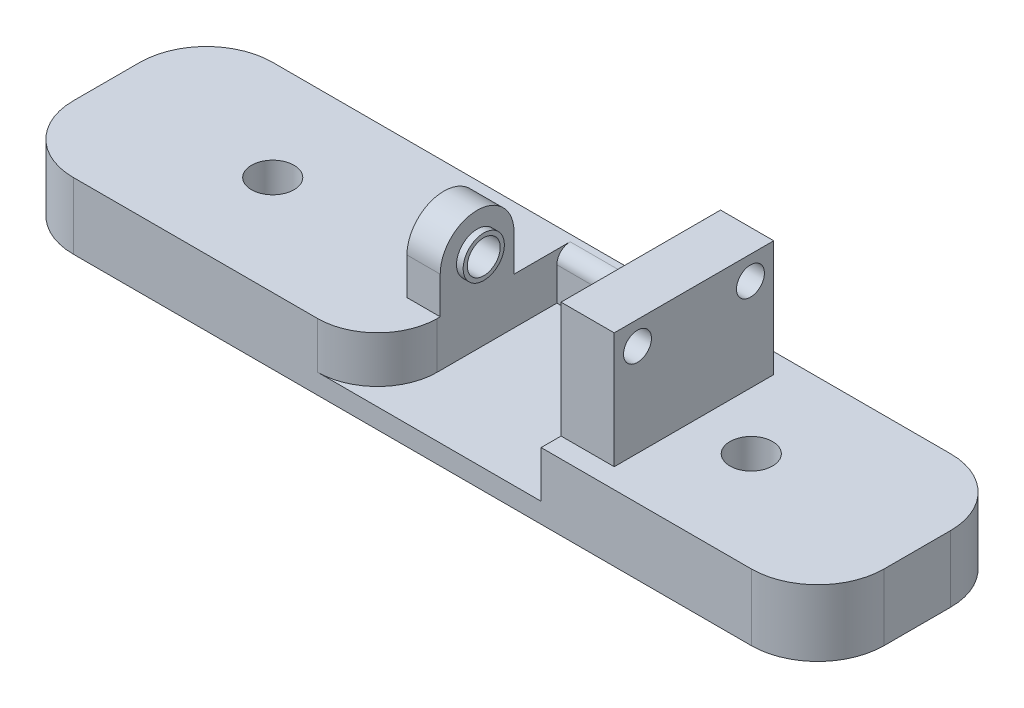
from build123d import *

# Parameters (mm, degrees)
SKETCH1_W           = 122
SKETCH1_H           = 30
BOSS_EXTRUDE1_DEPTH = 10
SKETCH2_W           = 24
SKETCH2_H           = 17.447802
BOSS_EXTRUDE2_DEPTH = 8
SKETCH3_R           = 2.475
BOSS_EXTRUDE3_DEPTH = 5
SKETCH4_W           = 24.63
SKETCH4_H           = 27
CUT_EXTRUDE1_DEPTH  = 7
FILLET1_R           = 10
SKETCH7_R           = 3.2
CUT_EXTRUDE2_DEPTH  = 66.195289666
BOSS_EXTRUDE5_START = 1
SKETCH8_R           = 3.1
SKETCH8_R_2         = 2.475
BOSS_EXTRUDE5_DEPTH = 1
FILLET2_R           = 9
FILLET3_R           = 2
SKETCH9_R           = 2.1
CUT_EXTRUDE3_DEPTH  = 8


with BuildPart() as part:
    # Sketch1 → Boss-Extrude1 (new body)
    with BuildSketch(Plane(origin=(0, 0, 0), x_dir=(1, 0, 0), z_dir=(0, 1, 0))):
        Rectangle(SKETCH1_W, SKETCH1_H)
    extrude(amount=BOSS_EXTRUDE1_DEPTH)

    # Sketch2 → Boss-Extrude2 (add)
    with BuildSketch(Plane(origin=(19.38, 0, 0), x_dir=(0, 0, -1), z_dir=(1, 0, 0))):
        with Locations((0, 18.723901)):
            Rectangle(SKETCH2_W, SKETCH2_H)
    extrude(amount=BOSS_EXTRUDE2_DEPTH)

    # Sketch3 → Boss-Extrude3 (add)
    with BuildSketch(Plane(origin=(-5.25, 0, 0), x_dir=(0, 0, -1), z_dir=(1, 0, 0))):
        with BuildLine():
            Line((-5.552198, 15.552198), (-5.552198, 10))
            Line((-5.552198, 10), (5.552198, 10))
            Line((5.552198, 10), (5.552198, 15.552198))
            ThreePointArc((5.552198, 15.552198), (0, 21.104396), (-5.552198, 15.552198))
        make_face()
        with Locations((0, 15.552198)):
            Circle(SKETCH3_R, mode=Mode.SUBTRACT)
    extrude(amount=-BOSS_EXTRUDE3_DEPTH)

    # Sketch4 → Cut-Extrude1 (cut)
    with BuildSketch(Plane(origin=(0, 10, 0), x_dir=(1, 0, 0), z_dir=(0, 1, 0))):
        with Locations((7.065, -1.5)):
            Rectangle(SKETCH4_W, SKETCH4_H)
    extrude(amount=-CUT_EXTRUDE1_DEPTH, mode=Mode.SUBTRACT)

    # Fillet1
    fillet1_edges = [part.edges().sort_by_distance(p)[0] for p in [
        (61, 5, 15),
        (-61, 5, 15),
        (-61, 5, -15),
        (61, 5, -15),
    ]]
    fillet(fillet1_edges, radius=FILLET1_R)

    # Sketch7 → Cut-Extrude2 (cut, through all)
    with BuildSketch(Plane(origin=(0, 10, 0), x_dir=(1, 0, 0), z_dir=(0, 1, 0))):
        with Locations(Location((-36, 0, 0), (0, 0, 270))):
            Circle(SKETCH7_R)
        with Locations(Location((36, 0, 0), (0, 0, 90))):
            Circle(SKETCH7_R)
    extrude(amount=-CUT_EXTRUDE2_DEPTH, mode=Mode.SUBTRACT)

    # Sketch8 → Boss-Extrude5 (add)
    with BuildSketch(Plane(origin=(-5.25, 0, 0), x_dir=(0, 0, -1), z_dir=(1, 0, 0)).offset(BOSS_EXTRUDE5_START)):
        with Locations((0, 15.552198)):
            Circle(SKETCH8_R)
        with Locations((0, 15.552198)):
            Circle(SKETCH8_R_2, mode=Mode.SUBTRACT)
    extrude(amount=-BOSS_EXTRUDE5_DEPTH)

    # Fillet2
    fillet2_edges = [part.edges().sort_by_distance(p)[0] for p in [
        (-5.25, 6.5, 15),
    ]]
    fillet(fillet2_edges, radius=FILLET2_R)

    # Fillet3
    fillet3_edges = [part.edges().sort_by_distance(p)[0] for p in [
        (7.065, 10, -12),
    ]]
    fillet(fillet3_edges, radius=FILLET3_R)

    # Sketch9 → Cut-Extrude3 (cut)
    with BuildSketch(Plane.ZY.offset(-19.38)):
        with Locations((8.5, 23.947802)):
            Circle(SKETCH9_R)
        with Locations((8.5, 6.947802)):
            Circle(SKETCH9_R)
        with Locations((-8.5, 6.947802)):
            Circle(SKETCH9_R)
        with Locations((-8.5, 23.947802)):
            Circle(SKETCH9_R)
    extrude(amount=-CUT_EXTRUDE3_DEPTH, mode=Mode.SUBTRACT)


solid = part.part
